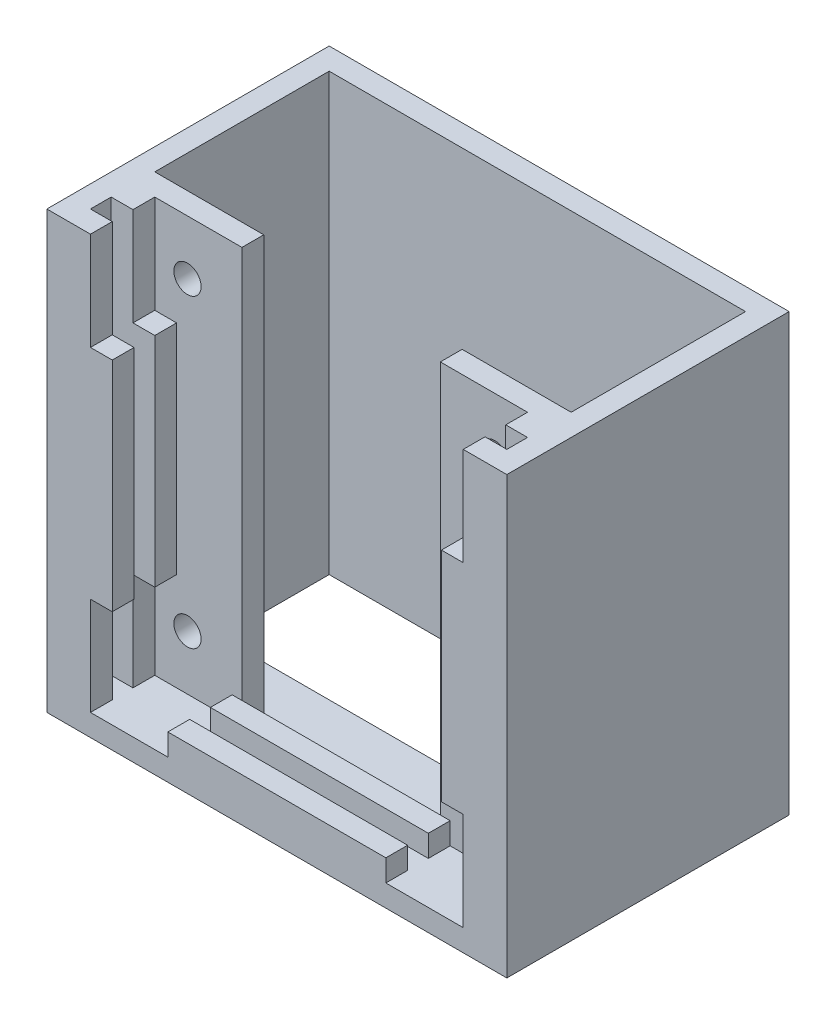
from build123d import *

# Parameters (mm, degrees)
BOSS_EXTRUDE1_DEPTH       = 38
BOSS_EXTRUDE1_2_DEPTH     = 38
SKETCH2_W                 = 42.2
SKETCH2_H                 = 5.9
BOSS_EXTRUDE2_DEPTH       = 2
BOSS_EXTRUDE3_DEPTH       = 18
SKETCH4_W                 = 42.2
SKETCH4_H                 = 40
BOSS_EXTRUDE4_DEPTH       = 2
SKETCH5_W                 = 38.2
SKETCH5_H                 = 11.95
CUT_EXTRUDE1_DEPTH        = 81.281509747
SKETCH6_W                 = 2
SKETCH6_H                 = 10
BOSS_EXTRUDE5_DEPTH       = 2
SKETCH7_W                 = 2
SKETCH7_H                 = 10
BOSS_EXTRUDE6_DEPTH       = 2
SKETCH8_W                 = 10
SKETCH8_H                 = 2
BOSS_EXTRUDE7_DEPTH       = 2
SKETCH9_W                 = 10
SKETCH9_H                 = 2
BOSS_EXTRUDE8_DEPTH       = 38
M3X0_5_TAPPED_HOLE1_D     = 2.5
M3X0_5_TAPPED_HOLE1_DEPTH = 7.9
M3X0_5_TAPPED_HOLE2_D     = 2.5
M3X0_5_TAPPED_HOLE2_DEPTH = 7.9


with BuildPart() as part:
    # Sketch1 → Boss-Extrude1 (new body)
    with BuildSketch(Plane(origin=(0, 0, 0), x_dir=(1, 0, 0), z_dir=(0, 1, 0))):
        Polygon((-62.898983402, -26.09346473), (-62.898983402, -24.19346473), (-60.898983402, -24.19346473), (-60.898983402, -22.19346473), (-64.898983402, -22.19346473), (-64.898983402, -28.09346473), (-60.898983402, -28.09346473), (-60.898983402, -26.09346473), align=None)
    extrude(amount=BOSS_EXTRUDE1_DEPTH)



with BuildPart() as body_2:
    # Sketch1 → Boss-Extrude1 2 (new body)
    with BuildSketch(Plane(origin=(0, 0, 0), x_dir=(1, 0, 0), z_dir=(0, 1, 0))):
        Polygon((-26.698983402, -22.19346473), (-26.698983402, -24.19346473), (-24.698983402, -24.19346473), (-24.698983402, -26.09346473), (-26.698983402, -26.09346473), (-26.698983402, -28.09346473), (-22.698983402, -28.09346473), (-22.698983402, -22.19346473), align=None)
    extrude(amount=BOSS_EXTRUDE1_2_DEPTH)


with BuildPart() as part_1:
    add(part.part)

    add(body_2.part)  # Boss-Extrude2 merges body 2
    # Sketch2 → Boss-Extrude2 (add)
    with BuildSketch(Plane(origin=(0, 0, 0), x_dir=(1, 0, 0), z_dir=(0, 1, 0))):
        with Locations((-43.798983402, -25.14346473)):
            Rectangle(SKETCH2_W, SKETCH2_H)
    extrude(amount=-BOSS_EXTRUDE2_DEPTH)

    # Sketch3 → Boss-Extrude3 (add)
    with BuildSketch(Plane(origin=(0, 0, 22.19346473), x_dir=(-1, 0, 0), z_dir=(0, 0, -1))):
        Polygon((24.698983402, 38), (22.698983402, 38), (22.698983402, -2), (64.898983402, -2), (64.898983402, 38), (62.898983402, 38), (62.898983402, 0), (24.698983402, 0), align=None)
    extrude(amount=BOSS_EXTRUDE3_DEPTH)

    # Sketch4 → Boss-Extrude4 (add)
    with BuildSketch(Plane(origin=(0, 0, 4.19346473), x_dir=(-1, 0, 0), z_dir=(0, 0, -1))):
        with Locations((43.798983402, 18)):
            Rectangle(SKETCH4_W, SKETCH4_H)
    extrude(amount=BOSS_EXTRUDE4_DEPTH)

    # Sketch5 → Cut-Extrude1 (cut, through all)
    with BuildSketch(Plane(origin=(0, 0, 0), x_dir=(1, 0, 0), z_dir=(0, 1, 0))):
        with Locations((-43.798983402, -10.16846473)):
            Rectangle(SKETCH5_W, SKETCH5_H)
    extrude(amount=-CUT_EXTRUDE1_DEPTH, mode=Mode.SUBTRACT)

    # Sketch6 → Boss-Extrude5 (add)
    with BuildSketch(Plane(origin=(-60.898983402, 0, 0), x_dir=(0, 0, -1), z_dir=(1, 0, 0))):
        with Locations((-27.09346473, 24)):
            Rectangle(SKETCH6_W, SKETCH6_H)
        with Locations((-23.19346473, 24)):
            Rectangle(SKETCH6_W, SKETCH6_H)
        with Locations((-27.09346473, 14)):
            Rectangle(SKETCH6_W, SKETCH6_H)
        with Locations((-23.19346473, 14)):
            Rectangle(SKETCH6_W, SKETCH6_H)
    extrude(amount=BOSS_EXTRUDE5_DEPTH)

    # Sketch7 → Boss-Extrude6 (add)
    with BuildSketch(Plane.ZY.offset(26.698983402)):
        with Locations((27.09346473, 24)):
            Rectangle(SKETCH7_W, SKETCH7_H)
        with Locations((27.09346473, 14)):
            Rectangle(SKETCH7_W, SKETCH7_H)
        with Locations((23.19346473, 14)):
            Rectangle(SKETCH7_W, SKETCH7_H)
        with Locations((23.19346473, 24)):
            Rectangle(SKETCH7_W, SKETCH7_H)
    extrude(amount=BOSS_EXTRUDE6_DEPTH)

    # Sketch8 → Boss-Extrude7 (add)
    with BuildSketch(Plane(origin=(0, 0, 0), x_dir=(1, 0, 0), z_dir=(0, 1, 0))):
        with Locations((-48.798983402, -23.19346473)):
            Rectangle(SKETCH8_W, SKETCH8_H)
        with Locations((-38.798983402, -23.19346473)):
            Rectangle(SKETCH8_W, SKETCH8_H)
        with Locations((-48.798983402, -27.09346473)):
            Rectangle(SKETCH8_W, SKETCH8_H)
        with Locations((-38.798983402, -27.09346473)):
            Rectangle(SKETCH8_W, SKETCH8_H)
    extrude(amount=BOSS_EXTRUDE7_DEPTH)

    # Sketch9 → Boss-Extrude8 (add)
    with BuildSketch(Plane(origin=(0, 0, 0), x_dir=(1, 0, 0), z_dir=(0, 1, 0))):
        with Locations((-57.898983402, -21.19346473)):
            Rectangle(SKETCH9_W, SKETCH9_H)
        with Locations((-29.698983402, -21.19346473)):
            Rectangle(SKETCH9_W, SKETCH9_H)
    extrude(amount=BOSS_EXTRUDE8_DEPTH)

    # M3x0.5 Tapped Hole1
    with Locations(Plane(origin=(-57.898983402, 33, 20.19346473), x_dir=(-1, 0, 0), z_dir=(0, 0, -1))):
        with Locations((0, 0), (0, -28)):
            Hole(M3X0_5_TAPPED_HOLE1_D / 2, depth=M3X0_5_TAPPED_HOLE1_DEPTH)

    # M3x0.5 Tapped Hole2
    with Locations(Plane(origin=(-29.698983402, 33, 20.19346473), x_dir=(-1, 0, 0), z_dir=(0, 0, -1))):
        with Locations((0, 0), (0, -28)):
            Hole(M3X0_5_TAPPED_HOLE2_D / 2, depth=M3X0_5_TAPPED_HOLE2_DEPTH)


solid = part_1.part
